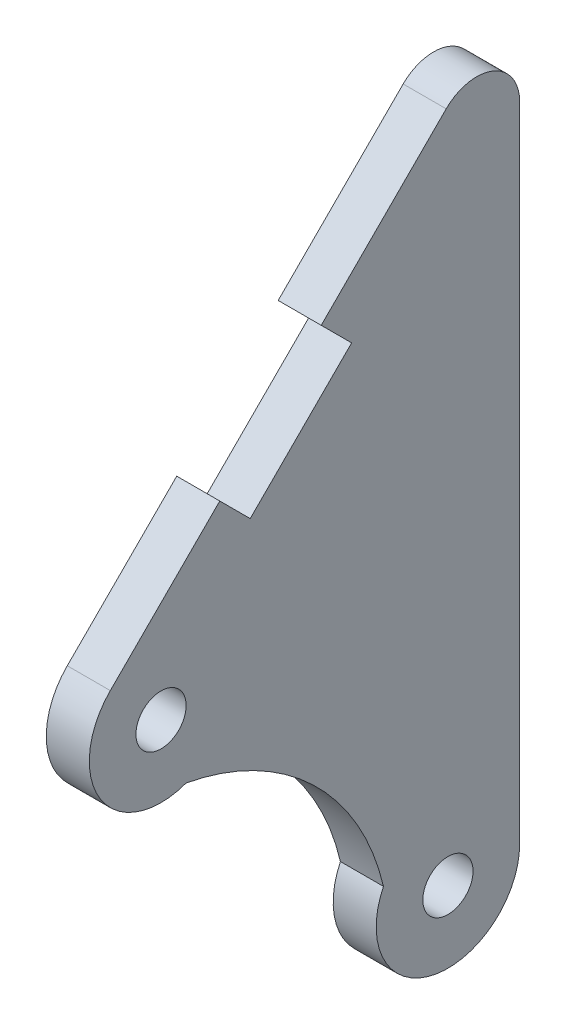
from build123d import *

# Parameters (mm, degrees)
CROQUIS1_R              = 1.75
SALIENTE_EXTRUIR1_DEPTH = 3


with BuildPart() as part:
    # Croquis1 → Saliente-Extruir1 (new body)
    with BuildSketch(Plane(origin=(0, 0, 0), x_dir=(0, 0, -1), z_dir=(1, 0, 0))):
        with BuildLine():
            Line((-23.535533906, 23.535533906), (-15.90493831, 31.166129502))
            Line((-15.90493831, 31.166129502), (-13.783617966, 29.044809158))
            Line((-13.783617966, 29.044809158), (-6.712550154, 36.11587697))
            Line((-6.712550154, 36.11587697), (-8.833870498, 38.237197314))
            Line((-8.833870498, 38.237197314), (-0.121320344, 46.949747468))
            ThreePointArc((-0.121320344, 46.949747468), (3.148050297, 47.600065722), (5, 44.828427125))
            Line((5, 44.828427125), (5, 0))
            ThreePointArc((5, 0), (-1.125347327, -4.871713599), (-4.493437357, 2.192947952))
            ThreePointArc((-4.493437357, 2.192947952), (-9.426479438, 10.796864219), (-18.255804358, 15.314086902))
            ThreePointArc((-18.255804358, 15.314086902), (-24.207168989, 17.298198916), (-23.535533906, 23.535533906))
        make_face()
        Circle(CROQUIS1_R, mode=Mode.SUBTRACT)
        with Locations((-20, 20)):
            Circle(CROQUIS1_R, mode=Mode.SUBTRACT)
    extrude(amount=SALIENTE_EXTRUIR1_DEPTH)


solid = part.part
